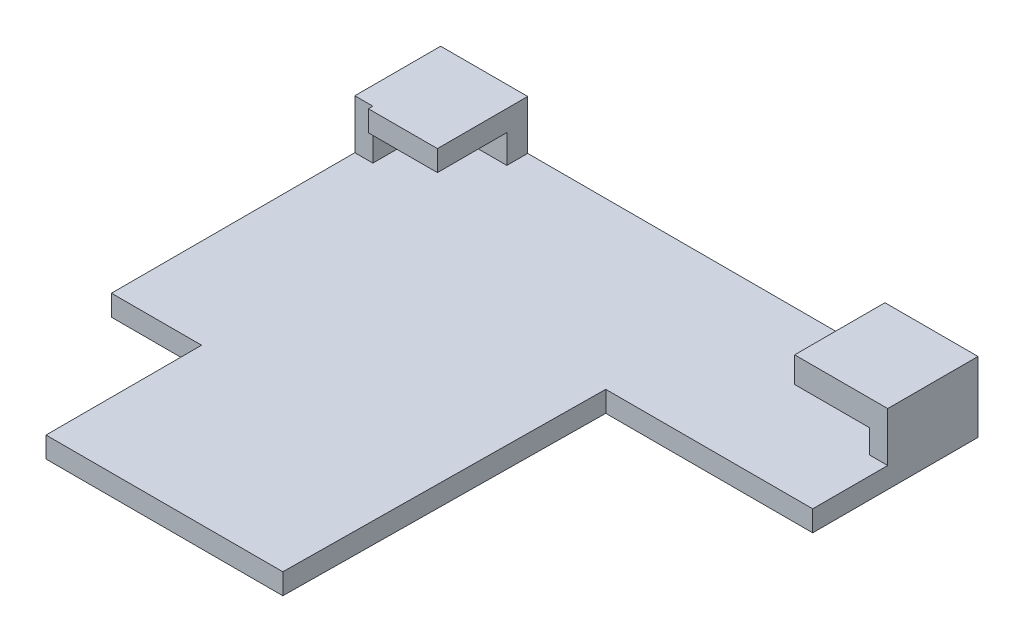
from build123d import *

# Parameters (mm, degrees)
BOSS_EXTRUDE1_DEPTH = 1.5
SKETCH2_W           = 35.686807758
SKETCH2_H           = 1.5
BOSS_EXTRUDE2_DEPTH = 1.5
SKETCH3_W           = 11.9
SKETCH3_H           = 1.5
BOSS_EXTRUDE3_DEPTH = 1.5
SKETCH4_W           = 23.7
SKETCH4_H           = 1.5
BOSS_EXTRUDE4_DEPTH = 1.5
BOSS_EXTRUDE5_DEPTH = 3.55
SKETCH6_W           = 4.966668371
SKETCH6_H           = 1.5
SKETCH6_W_2         = 5.4
SKETCH6_H_2         = 1.85
BOSS_EXTRUDE6_DEPTH = 5


with BuildPart() as part:
    # Sketch1 → Boss-Extrude1 (new body)
    with BuildSketch(Plane(origin=(0, 0, 0), x_dir=(1, 0, 0), z_dir=(0, 1, 0))):
        Polygon((-75.339050621, 34.683913692), (-39.639050621, 34.683913692), (-39.639050621, 24.283913692), (-53.039050621, 24.283913692), (-53.289050621, 1.283913692), (-70.339050621, 1.283913692), (-70.339050621, 12.483913692), (-75.339050621, 12.483913692), (-75.339050621, 24.283913692), align=None)
    extrude(amount=BOSS_EXTRUDE1_DEPTH)

    # Sketch2 → Boss-Extrude2 (add)
    with BuildSketch(Plane(origin=(0, 0, -34.683913692), x_dir=(-1, 0, 0), z_dir=(0, 0, -1))):
        with Locations((57.4824545, 0.75)):
            Rectangle(SKETCH2_W, SKETCH2_H)
    extrude(amount=BOSS_EXTRUDE2_DEPTH)

    # Sketch3 → Boss-Extrude3 (add)
    with BuildSketch(Plane(origin=(-39.639050621, 0, 0), x_dir=(0, 0, -1), z_dir=(1, 0, 0))):
        with Locations((30.233913692, 0.75)):
            Rectangle(SKETCH3_W, SKETCH3_H)
    extrude(amount=BOSS_EXTRUDE3_DEPTH)

    # Sketch4 → Boss-Extrude4 (add)
    with BuildSketch(Plane.ZY.offset(75.325858379)):
        with Locations((-24.333913692, 0.75)):
            Rectangle(SKETCH4_W, SKETCH4_H)
    extrude(amount=BOSS_EXTRUDE4_DEPTH)

    # Sketch5 → Boss-Extrude5 (add)
    with BuildSketch(Plane(origin=(0, 1.5, 0), x_dir=(1, 0, 0), z_dir=(0, 1, 0))):
        Polygon((-75.525858379, 34.683913692), (-75.525858379, 30.004194868), (-76.825858379, 30.004194868), (-76.825858379, 36.183913692), (-70.559190008, 36.183913692), (-70.559190008, 34.683913692), align=None)
        Polygon((-39.439050621, 34.683913692), (-39.439050621, 29.683913692), (-38.139050621, 29.683913692), (-38.139050621, 36.183913692), (-44.839050621, 36.183913692), (-44.839050621, 34.683913692), align=None)
    extrude(amount=BOSS_EXTRUDE5_DEPTH)

    # Sketch6 → Boss-Extrude6 (add)
    with BuildSketch(Plane.XY.offset(-34.683913692)):
        with Locations((-73.042524194, 4.3)):
            Rectangle(SKETCH6_W, SKETCH6_H)
        with Locations((-42.139050621, 4.125)):
            Rectangle(SKETCH6_W_2, SKETCH6_H_2)
    extrude(amount=BOSS_EXTRUDE6_DEPTH)


solid = part.part
